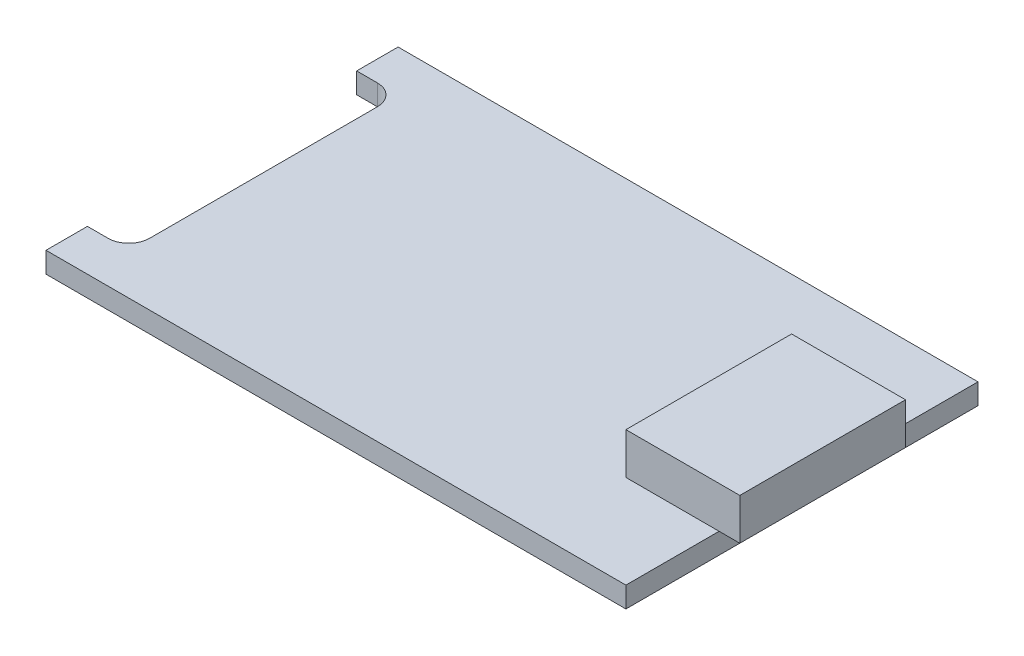
from build123d import *

# Parameters (mm, degrees)
SKETCH1_W           = 28
SKETCH1_H           = 17
BOSS_EXTRUDE1_DEPTH = 1
SKETCH2_W           = 5.5
SKETCH2_H           = 8
BOSS_EXTRUDE2_DEPTH = 2
SKETCH3_W           = 2
SKETCH3_H           = 13
CUT_EXTRUDE1_DEPTH  = 18.356554958
FILLET1_R           = 1


with BuildPart() as part:
    # Sketch1 → Boss-Extrude1 (new body)
    with BuildSketch(Plane(origin=(0, 0, 0), x_dir=(1, 0, 0), z_dir=(0, 1, 0))):
        Rectangle(SKETCH1_W, SKETCH1_H)
    extrude(amount=BOSS_EXTRUDE1_DEPTH)

    # Sketch2 → Boss-Extrude2 (add)
    with BuildSketch(Plane(origin=(0, 1, 0), x_dir=(1, 0, 0), z_dir=(0, 1, 0))):
        with Locations((12.25, 0)):
            Rectangle(SKETCH2_W, SKETCH2_H)
    extrude(amount=BOSS_EXTRUDE2_DEPTH)

    # Sketch3 → Cut-Extrude1 (cut, through all)
    with BuildSketch(Plane(origin=(0, 1, 0), x_dir=(1, 0, 0), z_dir=(0, 1, 0))):
        with Locations((-13, 0)):
            Rectangle(SKETCH3_W, SKETCH3_H)
    extrude(amount=-CUT_EXTRUDE1_DEPTH, mode=Mode.SUBTRACT)

    # Fillet1
    fillet1_edges = [part.edges().sort_by_distance(p)[0] for p in [
        (-12, 0.5, -6.5),
        (-12, 0.5, 6.5),
    ]]
    fillet(fillet1_edges, radius=FILLET1_R)


solid = part.part
